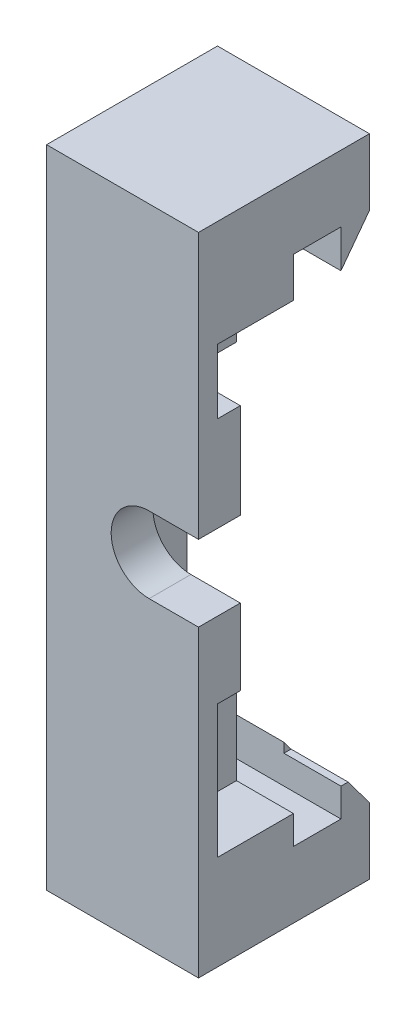
from build123d import *

# Parameters (mm, degrees)
SKETCH1_W           = 4
SKETCH1_H           = 17
BOSS_EXTRUDE1_DEPTH = 6
SKETCH2_W           = 2.8
SKETCH2_H           = 6.5
SKETCH2_W_2         = 1.5
SKETCH2_H_2         = 2.75
CUT_EXTRUDE1_DEPTH  = 19.466185313
CUT_EXTRUDE2_DEPTH  = 19.466185313
SKETCH4_W           = 2
SKETCH4_H           = 2.75
BOSS_EXTRUDE2_DEPTH = 2
SKETCH6_W           = 1.5
SKETCH6_H           = 1.7
SKETCH6_H_2         = 0.75
CUT_EXTRUDE3_DEPTH  = 2
BOSS_EXTRUDE3_REACH = 20.244
SKETCH7_W           = 2.6
SKETCH7_H           = 6.5
CUT_EXTRUDE4_DEPTH  = 10
SKETCH9_W           = 1.5
SKETCH9_H           = 17
CUT_EXTRUDE5_DEPTH  = 19.466185313


with BuildPart() as part:
    # Sketch1 → Boss-Extrude1 (new body)
    with BuildSketch(Plane.XY):
        with Locations((2, 8.5)):
            Rectangle(SKETCH1_W, SKETCH1_H)
    extrude(amount=BOSS_EXTRUDE1_DEPTH)

    # Sketch2 → Cut-Extrude1 (cut, through all)
    with BuildSketch(Plane.XY.offset(6)):
        with Locations((2.6, 9.25)):
            Rectangle(SKETCH2_W, SKETCH2_H)
        with Locations((3.25, 3.875)):
            Rectangle(SKETCH2_W_2, SKETCH2_H_2)
    extrude(amount=-CUT_EXTRUDE1_DEPTH, mode=Mode.SUBTRACT)

    # Sketch3 → Cut-Extrude2 (cut, through all)
    with BuildSketch(Plane.ZY):
        Polygon((0, 15.25), (0.75, 14.25), (0.75, 15.25), (2, 15.25), (2, 1.75), (0.75, 1.75), (0.75, 2.75), (0, 1.75), align=None)
    extrude(amount=-CUT_EXTRUDE2_DEPTH, mode=Mode.SUBTRACT)

    # Sketch4 → Boss-Extrude2 (add)
    with BuildSketch(Plane(origin=(4, 0, 0), x_dir=(0, 0, -1), z_dir=(1, 0, 0))):
        with Locations((-5, 3.875)):
            Rectangle(SKETCH4_W, SKETCH4_H)
    extrude(amount=-BOSS_EXTRUDE2_DEPTH)

    # Sketch6 → Cut-Extrude3 (cut)
    with BuildSketch(Plane(origin=(0, 0, 2), x_dir=(-1, 0, 0), z_dir=(0, 0, -1))):
        with Locations((-3.25, 13.35)):
            Rectangle(SKETCH6_W, SKETCH6_H)
        with Locations((-3.25, 5.625)):
            Rectangle(SKETCH6_W, SKETCH6_H_2)
    extrude(amount=-CUT_EXTRUDE3_DEPTH, mode=Mode.SUBTRACT)

    # Boss-Extrude3: up to this face of the body (flat: up to its plane)
    boss_extrude3_end = Plane(part.part.faces().sort_by_distance((4, 15.271515562, 3.544654939))[0])
    # Sketch7 → Boss-Extrude3 (add, up to the picked face)
    with BuildSketch(Plane(origin=(1.2, 0, 0), x_dir=(0, 0, -1), z_dir=(1, 0, 0)), mode=Mode.PRIVATE) as boss_extrude3_sk1:
        with Locations((-4.7, 9.25)):
            Rectangle(SKETCH7_W, SKETCH7_H)
    boss_extrude3_tool1 = split(extrude(boss_extrude3_sk1.sketch, amount=BOSS_EXTRUDE3_REACH, mode=Mode.PRIVATE), bisect_by=boss_extrude3_end, keep=Keep.BOTH, mode=Mode.PRIVATE)
    add(boss_extrude3_tool1.solids().sort_by(Axis((1.2, 9.25, 4.7), (1, 0, 0)))[0])

    # Sketch8 → Cut-Extrude4 (cut)
    with BuildSketch(Plane(origin=(0, 0, 3.4), x_dir=(-1, 0, 0), z_dir=(0, 0, -1))):
        with BuildLine():
            Line((-2.7, 10), (-4, 10))
            Line((-4, 10), (-4, 8))
            Line((-4, 8), (-2.7, 8))
            ThreePointArc((-2.7, 8), (-1.7, 9), (-2.7, 10))
        make_face()
    extrude(amount=-CUT_EXTRUDE4_DEPTH, mode=Mode.SUBTRACT)

    # Sketch9 → Cut-Extrude5 (cut, through all)
    with BuildSketch(Plane(origin=(4, 0, 0), x_dir=(0, 0, -1), z_dir=(1, 0, 0))):
        with Locations((-5.25, 8.5)):
            Rectangle(SKETCH9_W, SKETCH9_H)
    extrude(amount=-CUT_EXTRUDE5_DEPTH, mode=Mode.SUBTRACT)


solid = part.part
